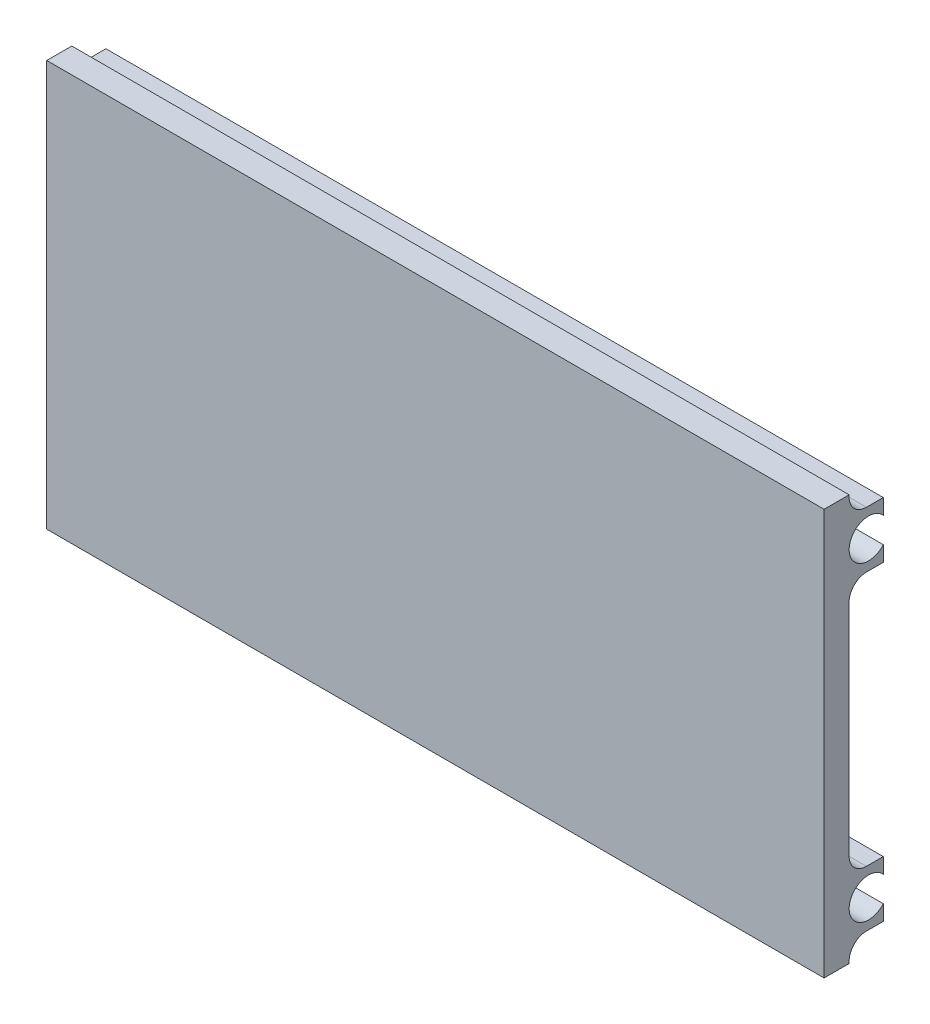
from build123d import *

# Parameters (mm, degrees)
EXTRUDE_1_DEPTH             = 90
SKETCH_2_W                  = 90
SKETCH_2_H                  = 17.75
EXTRUDE_2_DEPTH             = 8.2
SKETCH_3_W                  = 90
SKETCH_3_H                  = 50.95
EXTRUDE_3_DEPTH             = 8.2
SKETCH_4_W                  = 3.95
SKETCH_4_H                  = 29.5
CUT_EXTRUDE_1_DEPTH         = 96.44153315
SKETCH_5_W                  = 3.95
SKETCH_5_H                  = 6.2
CUT_EXTRUDE_2_DEPTH         = 96.44153315
SKETCH_6_W                  = 2.25
SKETCH_6_H                  = 3.95
CUT_EXTRUDE_3_DEPTH         = 96.44153315
SKETCH_7_W                  = 4.5
SKETCH_7_H                  = 3.95
CUT_EXTRUDE_4_DEPTH         = 96.44153315
SKETCH_8_W                  = 2.25
SKETCH_8_H                  = 3.95
CUT_EXTRUDE_5_DEPTH         = 96.44153315
SKETCH_9_W                  = 3.95
SKETCH_9_H                  = 2.25
CUT_EXTRUDE_6_DEPTH         = 96.44153315
SKETCH_10_W                 = 20.2
SKETCH_10_H                 = 45.2
CUT_EXTRUDE_7_DEPTH         = 86
HOLE_WIZARD_2_5_2_5_1_D     = 2.5
HOLE_WIZARD_4_5_4_5_1_D     = 4.5
HOLE_WIZARD_8_3_8_3_1_D     = 8.3
HOLE_WIZARD_8_3_8_3_1_DEPTH = 3.2
FILLET_1_R                  = 2
FILLET_2_R                  = 2
EXTRUDE_START               = -90
SKETCH_17_R                 = 1.25
EXTRUDE_4_DEPTH             = 90
CUT_EXTRUDE_START           = -100
SKETCH_18_R                 = 4.15
CUT_EXTRUDE_8_DEPTH         = 100
CUT_EXTRUDE_9_DEPTH         = 110
CUT_EXTRUDE_10_DEPTH        = 110
SKETCH_21_W                 = 90
SKETCH_21_H                 = 47
EXTRUDE_5_DEPTH             = 2


with BuildPart() as part:
    # Эскиз1 → Бобышка-Вытянуть1 (new body)
    with BuildSketch(Plane(origin=(90, 0, 0), x_dir=(0, 0, -1), z_dir=(1, 0, 0))):
        with BuildLine():
            Line((6.75, -24.093761792), (6.75, 19.25))
            Line((6.75, 19.25), (-11.593761792, 19.25))
            ThreePointArc((-11.593761792, 19.25), (-15.325, 18), (-11.593761792, 16.75))
            Line((-11.593761792, 16.75), (-11, 16.75))
            Line((-11, 16.75), (-11, -16.75))
            Line((-11, -16.75), (-11.593761792, -16.75))
            ThreePointArc((-11.593761792, -16.75), (-15.325, -18), (-11.593761792, -19.25))
            Line((-11.593761792, -19.25), (-11, -19.25))
            Line((-11, -19.25), (-11, -23.5))
            Line((-11, -23.5), (-6.75, -23.5))
            Line((-6.75, -23.5), (-6.75, -24.093761792))
            ThreePointArc((-6.75, -24.093761792), (-5.5, -27.825), (-4.25, -24.093761792))
            Line((-4.25, -24.093761792), (-4.25, -23.5))
            Line((-4.25, -23.5), (4.25, -23.5))
            Line((4.25, -23.5), (4.25, -24.093761792))
            ThreePointArc((4.25, -24.093761792), (5.5, -27.825), (6.75, -24.093761792))
        make_face()
    extrude(amount=-EXTRUDE_1_DEPTH)

    # Эскиз2 → Бобышка-Вытянуть2 (add)
    with BuildSketch(Plane(origin=(0, 19.25, 0), x_dir=(-1, 0, 0), z_dir=(0, 1, 0))):
        with Locations((-45, 2.125)):
            Rectangle(SKETCH_2_W, SKETCH_2_H)
    extrude(amount=EXTRUDE_2_DEPTH)

    # Эскиз3 → Бобышка-Вытянуть3 (add)
    with BuildSketch(Plane(origin=(0, 0, -6.75), x_dir=(-1, 0, 0), z_dir=(0, 0, -1))):
        with Locations((-45, 1.975)):
            Rectangle(SKETCH_3_W, SKETCH_3_H)
    extrude(amount=EXTRUDE_3_DEPTH)

    # Эскиз4 → Вырез-Вытянуть1 (cut, through all)
    with BuildSketch(Plane.ZY):
        with Locations((-12.975, 0)):
            Rectangle(SKETCH_4_W, SKETCH_4_H)
    extrude(amount=-CUT_EXTRUDE_1_DEPTH, mode=Mode.SUBTRACT)

    # Эскиз5 → Вырез-Вытянуть2 (cut, through all)
    with BuildSketch(Plane.ZY):
        with Locations((-12.975, 24.35)):
            Rectangle(SKETCH_5_W, SKETCH_5_H)
    extrude(amount=-CUT_EXTRUDE_2_DEPTH, mode=Mode.SUBTRACT)

    # Эскиз6 → Вырез-Вытянуть3 (cut, through all)
    with BuildSketch(Plane.ZY):
        with Locations((-9.875, 25.475)):
            Rectangle(SKETCH_6_W, SKETCH_6_H)
    extrude(amount=-CUT_EXTRUDE_3_DEPTH, mode=Mode.SUBTRACT)

    # Эскиз7 → Вырез-Вытянуть4 (cut, through all)
    with BuildSketch(Plane.ZY):
        with Locations((0, 25.475)):
            Rectangle(SKETCH_7_W, SKETCH_7_H)
    extrude(amount=-CUT_EXTRUDE_4_DEPTH, mode=Mode.SUBTRACT)

    # Эскиз8 → Вырез-Вытянуть5 (cut, through all)
    with BuildSketch(Plane.ZY):
        with Locations((9.875, 25.475)):
            Rectangle(SKETCH_8_W, SKETCH_8_H)
    extrude(amount=-CUT_EXTRUDE_5_DEPTH, mode=Mode.SUBTRACT)

    # Эскиз9 → Вырез-Вытянуть6 (cut, through all)
    with BuildSketch(Plane.ZY):
        with Locations((-12.975, -22.375)):
            Rectangle(SKETCH_9_W, SKETCH_9_H)
    extrude(amount=-CUT_EXTRUDE_6_DEPTH, mode=Mode.SUBTRACT)

    # Эскиз10 → Вырез-Вытянуть7 (cut)
    with BuildSketch(Plane(origin=(90, 0, 0), x_dir=(0, 0, -1), z_dir=(1, 0, 0))):
        Rectangle(SKETCH_10_W, SKETCH_10_H)
    extrude(amount=-CUT_EXTRUDE_7_DEPTH, mode=Mode.SUBTRACT)

    # Диаметр отверстия Ø2.5 (2.5)1 (through all)
    with Locations(Plane(origin=(90, 0, 0), x_dir=(0, 0, -1), z_dir=(1, 0, 0))):
        with Locations((5.5, -25.75), (-13.25, -18), (-5.5, -25.75), (-13.25, 18)):
            Hole(HOLE_WIZARD_2_5_2_5_1_D / 2)

    # Диаметр отверстия Ø4.5 (4.5)1 (through all)
    with Locations(Plane.ZY):
        with Locations((-13.25, -18), (-13.25, 18), (-5.5, 25.75), (5.5, 25.75)):
            Hole(HOLE_WIZARD_4_5_4_5_1_D / 2)

    # Диаметр отверстия Ø8.3 (8.3)1
    with Locations(Plane.ZY):
        with Locations((0, 0)):
            Hole(HOLE_WIZARD_8_3_8_3_1_D / 2, depth=HOLE_WIZARD_8_3_8_3_1_DEPTH)

    # Скругление1
    fillet_1_edges = [part.edges().sort_by_distance(p)[0] for p in [
        (45, 23.5, 8.75),
    ]]
    fillet(fillet_1_edges, radius=FILLET_1_R)

    # Скругление2
    fillet_2_edges = [part.edges().sort_by_distance(p)[0] for p in [
        (45, 23.5, -8.75),
        (45, 23.5, 2.25),
        (45, 23.5, -2.25),
        (45, -21.25, -11),
        (4, 0, -10.1),
        (4, -22.6, 0),
        (4, 0, 10.1),
        (4, 22.6, 0),
        (45, 14.75, -11),
        (45, -14.75, -11),
        (45, 21.25, -11),
    ]]
    fillet(fillet_2_edges, radius=FILLET_2_R)

    # Эскиз17 → Бобышка-Вытянуть4 (add)
    with BuildSketch(Plane(origin=(90, 0, 0), x_dir=(0, 0, -1), z_dir=(1, 0, 0)).offset(EXTRUDE_START)):
        with Locations((5.5, -25.75)):
            Circle(SKETCH_17_R)
        with Locations((-5.5, -25.75)):
            Circle(SKETCH_17_R)
        with Locations((-13.25, -18)):
            Circle(SKETCH_17_R)
        with Locations((-13.25, 18)):
            Circle(SKETCH_17_R)
    extrude(amount=EXTRUDE_4_DEPTH)

    # Эскиз18 → Вырез-Вытянуть8 (cut)
    with BuildSketch(Plane.ZY.offset(CUT_EXTRUDE_START)):
        Circle(SKETCH_18_R)
    extrude(amount=CUT_EXTRUDE_8_DEPTH, mode=Mode.SUBTRACT)

    # Эскиз19 → Вырез-Вытянуть9 (cut)
    with BuildSketch(Plane(origin=(90, 0, 0), x_dir=(0, 0, -1), z_dir=(1, 0, 0))):
        Polygon((10.1, -22.6), (10.1, 22.6), (10.1, 31.019338608), (-21.722605493, 31.019338608), (-21.722605493, -29.745467662), (10.1, -29.745467662), align=None)
    extrude(amount=-CUT_EXTRUDE_9_DEPTH, mode=Mode.SUBTRACT)

    # Эскиз20 → Вырез-Вытянуть10 (cut)
    with BuildSketch(Plane(origin=(90, 0, 0), x_dir=(0, 0, -1), z_dir=(1, 0, 0))):
        with BuildLine():
            Line((10.1, 23.5), (10.1, 23.608571968))
            ThreePointArc((10.1, 23.608571968), (10.420497393, 23.52732972), (10.75, 23.5))
            Line((10.75, 23.5), (10.1, 23.5))
        make_face()
    extrude(amount=-CUT_EXTRUDE_10_DEPTH, mode=Mode.SUBTRACT)

    # Эскиз21 → Бобышка-Вытянуть5 (add)
    with BuildSketch(Plane.XY.offset(-10.1)):
        with Locations((45, 0)):
            Rectangle(SKETCH_21_W, SKETCH_21_H)
    extrude(amount=EXTRUDE_5_DEPTH)


solid = part.part
